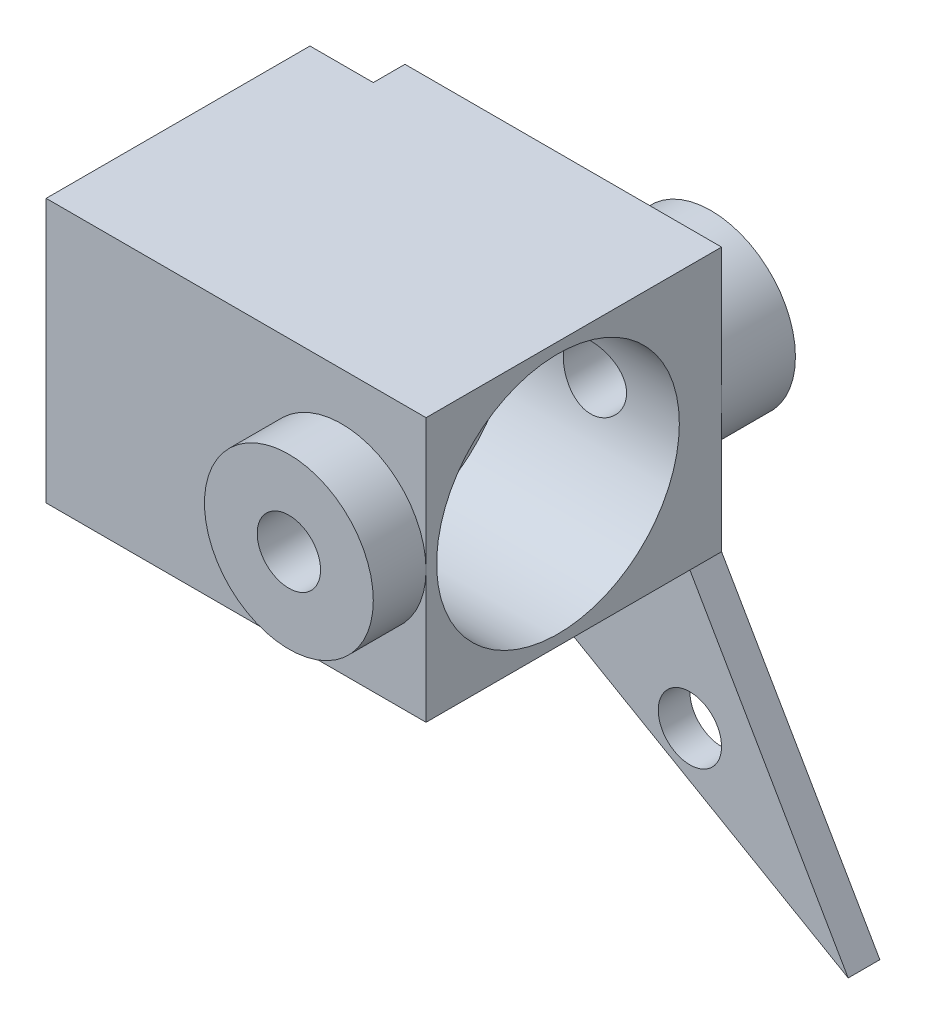
from build123d import *

# Parameters (mm, degrees)
SKETCH_1_W          = 35
SKETCH_1_H          = 25
SKETCH_1_R          = 8
EXTRUDE_2_DEPTH     = 25
SKETCH_2_R          = 8
EXTRUDE_3_DEPTH     = 5
EXTRUDE_START       = 10
SKETCH_3_R          = 8
EXTRUDE_4_DEPTH     = 10
SKETCH_4_R          = 3
CUT_EXTRUDE_1_DEPTH = 46.414755311
SKETCH_5_R          = 11.5
CUT_EXTRUDE_2_DEPTH = 16
SKETCH_6_R          = 4
EXTRUDE_5_DEPTH     = 15
SKETCH_8_W          = 3
SKETCH_8_H          = 2.025472792
CUT_EXTRUDE_3_DEPTH = 15
EXTRUDE_START_2     = -2
SKETCH_9_R          = 4
EXTRUDE_6_DEPTH     = 2
SKETCH_10_R         = 4
EXTRUDE_7_DEPTH     = 2
EXTRUDE_START_3     = 3
SKETCH_12_R         = 3
SKETCH_12_R_2       = 8
EXTRUDE_11_DEPTH    = 3
SKETCH_14_W         = 6.627877622
SKETCH_14_H         = 25
CUT_EXTRUDE_4_DEPTH = 3
SKETCH_15_W         = 25
SKETCH_15_H         = 25
CUT_EXTRUDE_5_DEPTH = 70.862501092
SKETCH_16_W         = 25
SKETCH_16_H         = 25
SKETCH_16_R         = 4
EXTRUDE_12_DEPTH    = 1


with BuildPart() as part:
    # 草图1 → 凸台-拉伸2 (new body)
    # profile 1 of 2: a face of its own
    with BuildSketch(Plane.XY):
        Rectangle(SKETCH_1_W, SKETCH_1_H)
        with Locations((9.5, 0)):
            Circle(SKETCH_1_R, mode=Mode.SUBTRACT)
    # profile 2 of 2: a face of its own
    with BuildSketch(Plane.XY):
        with Locations((9.5, 0)):
            Circle(SKETCH_1_R)
    extrude(amount=EXTRUDE_2_DEPTH)

    # 草图2 → 凸台-拉伸3 (add)
    with BuildSketch(Plane.XY.offset(25)):
        with Locations((9.5, 0)):
            Circle(SKETCH_2_R)
    extrude(amount=EXTRUDE_3_DEPTH)

    # 草图3 → 凸台-拉伸4 (add)
    with BuildSketch(Plane(origin=(0, 0, 0), x_dir=(-1, 0, 0), z_dir=(0, 0, -1)).offset(EXTRUDE_START)):
        with Locations(Location((-9.5, 0, 0), (0, 0, 180))):
            Circle(SKETCH_3_R)
    extrude(amount=-EXTRUDE_4_DEPTH)

    # 草图4 → 切除-拉伸1 (cut, through all)
    with BuildSketch(Plane.XY.offset(30)):
        with Locations((9.5, 0)):
            Circle(SKETCH_4_R)
    extrude(amount=-CUT_EXTRUDE_1_DEPTH, mode=Mode.SUBTRACT)

    # 草图5 → 切除-拉伸2 (cut)
    with BuildSketch(Plane(origin=(17.5, 0, 0), x_dir=(0, 0, -1), z_dir=(1, 0, 0))):
        with Locations((-12.5, 0)):
            Circle(SKETCH_5_R)
    extrude(amount=-CUT_EXTRUDE_2_DEPTH, mode=Mode.SUBTRACT)

    # 草图6 → 凸台-拉伸5 (add)
    with BuildSketch(Plane.ZY.offset(17.5)):
        with Locations((12.5, 0)):
            Circle(SKETCH_6_R)
    extrude(amount=EXTRUDE_5_DEPTH)

    # 草图8 → 切除-拉伸3 (cut)
    with BuildSketch(Plane.ZY.offset(17.5)):
        with Locations((17, 0)):
            Rectangle(SKETCH_8_W, SKETCH_8_H)
    extrude(amount=CUT_EXTRUDE_3_DEPTH, mode=Mode.SUBTRACT)

    # 草图9 → 凸台-拉伸6 (add)
    with BuildSketch(Plane.ZY.offset(32.5).offset(EXTRUDE_START_2)):
        with Locations(Location((12.5, 0, 0), (0, 0, 14.666011097))):
            Circle(SKETCH_9_R)
    extrude(amount=EXTRUDE_6_DEPTH)

    # 草图10 → 凸台-拉伸7 (add)
    with BuildSketch(Plane.ZY.offset(17.5)):
        with Locations((12.5, 0)):
            Circle(SKETCH_10_R)
    extrude(amount=EXTRUDE_7_DEPTH)

    # 草图12 → 凸台-拉伸11 (add)
    with BuildSketch(Plane(origin=(0, 0, 0), x_dir=(-1, 0, 0), z_dir=(0, 0, -1)).offset(EXTRUDE_START_3)):
        Polygon((12.5, 12.5), (-24.127877622, 12.5), (-24.127877622, -12.5), (-17.5, -12.5), (-32.5, -38.480762114), (12.5, -12.5), align=None)
        with Locations((-17.5, -25.490381057)):
            Circle(SKETCH_12_R, mode=Mode.SUBTRACT)
        with Locations(Location((-9.5, 0, 0), (0, 0, 180))):
            Circle(SKETCH_12_R_2, mode=Mode.SUBTRACT)
    extrude(amount=-EXTRUDE_11_DEPTH)

    # 草图14 → 切除-拉伸4 (cut)
    with BuildSketch(Plane.XY):
        with Locations((20.813938811, 0)):
            Rectangle(SKETCH_14_W, SKETCH_14_H)
    extrude(amount=-CUT_EXTRUDE_4_DEPTH, mode=Mode.SUBTRACT)

    # 草图15 → 切除-拉伸5 (cut, through all)
    with BuildSketch(Plane.ZY.offset(17.5)):
        with Locations((12.5, 0)):
            Rectangle(SKETCH_15_W, SKETCH_15_H)
    extrude(amount=CUT_EXTRUDE_5_DEPTH, mode=Mode.SUBTRACT)

    # 草图16 → 凸台-拉伸12 (add)
    with BuildSketch(Plane.ZY.offset(17.5)):
        with Locations((12.5, 0)):
            Rectangle(SKETCH_16_W, SKETCH_16_H)
        with Locations((12.5, 0)):
            Circle(SKETCH_16_R, mode=Mode.SUBTRACT)
    extrude(amount=EXTRUDE_12_DEPTH)


solid = part.part
